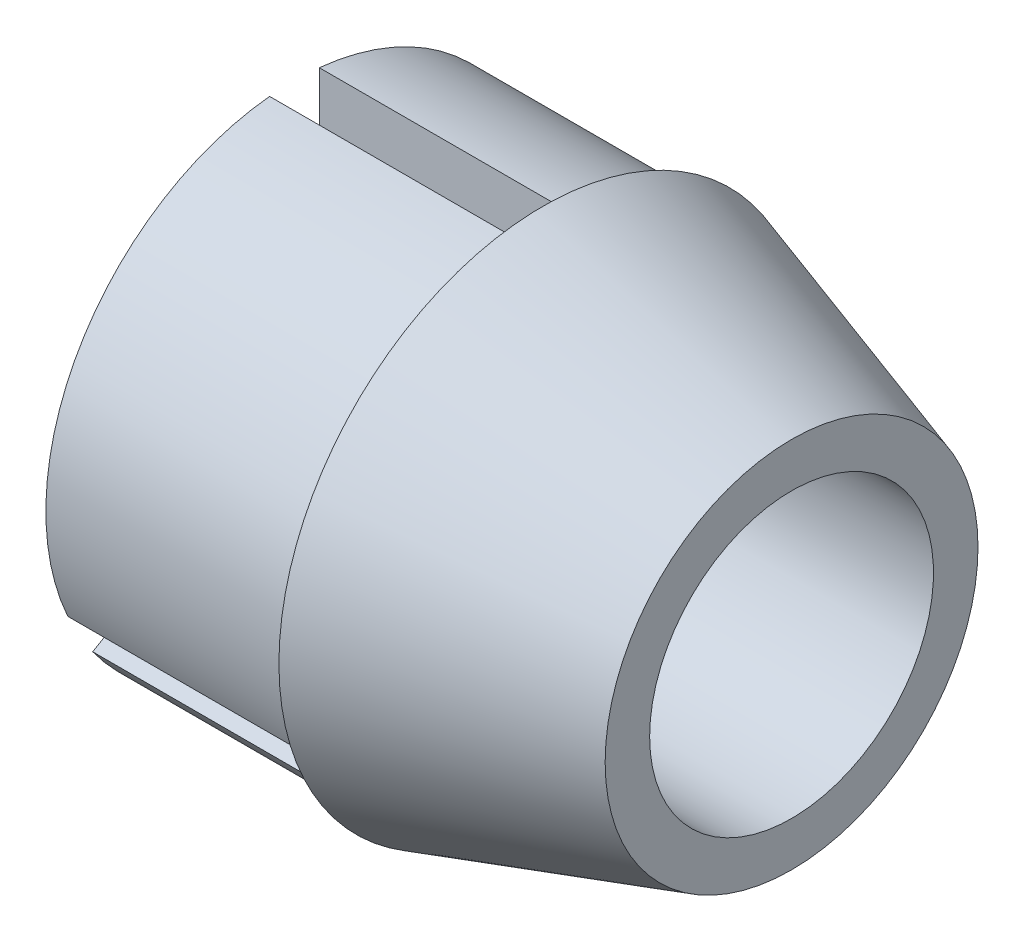
from build123d import *

# Parameters (mm, degrees)
SKETCH2_W          = 5.08
SKETCH2_H          = 25.4
CUT_EXTRUDE1_DEPTH = 25.4


with BuildPart() as part:
    # Sketch1 → Revolve1 (revolve)
    with BuildSketch(Plane.XY, mode=Mode.PRIVATE) as revolve1_sk:
        Polygon((0, 14.5034), (25.4, 14.5034), (25.4, 19.05), (0, 26.9875), (0, 25.4), (-25.4, 25.4), (-25.4, 16.0909), (0, 16.0909), align=None)
    revolve(revolve1_sk.sketch.rotate(Axis((-1.27, 0, 0), (1, 0, 0)), 90), axis=Axis((-1.27, 0, 0), (1, 0, 0)))

    # Sketch2 → Cut-Extrude1 (cut)
    with BuildSketch(Plane.ZY.offset(25.4)):
        Polygon((28.76630657, -13.675295474), (6.769261314, -0.975295474), (4.229261314, -5.374704526), (26.22630657, -18.074704526), align=None)
        with Locations((0, 19.05)):
            Rectangle(SKETCH2_W, SKETCH2_H)
        Polygon((-26.22630657, -18.074704526), (-4.229261314, -5.374704526), (-6.769261314, -0.975295474), (-28.76630657, -13.675295474), align=None)
    extrude(amount=-CUT_EXTRUDE1_DEPTH, mode=Mode.SUBTRACT)


solid = part.part
